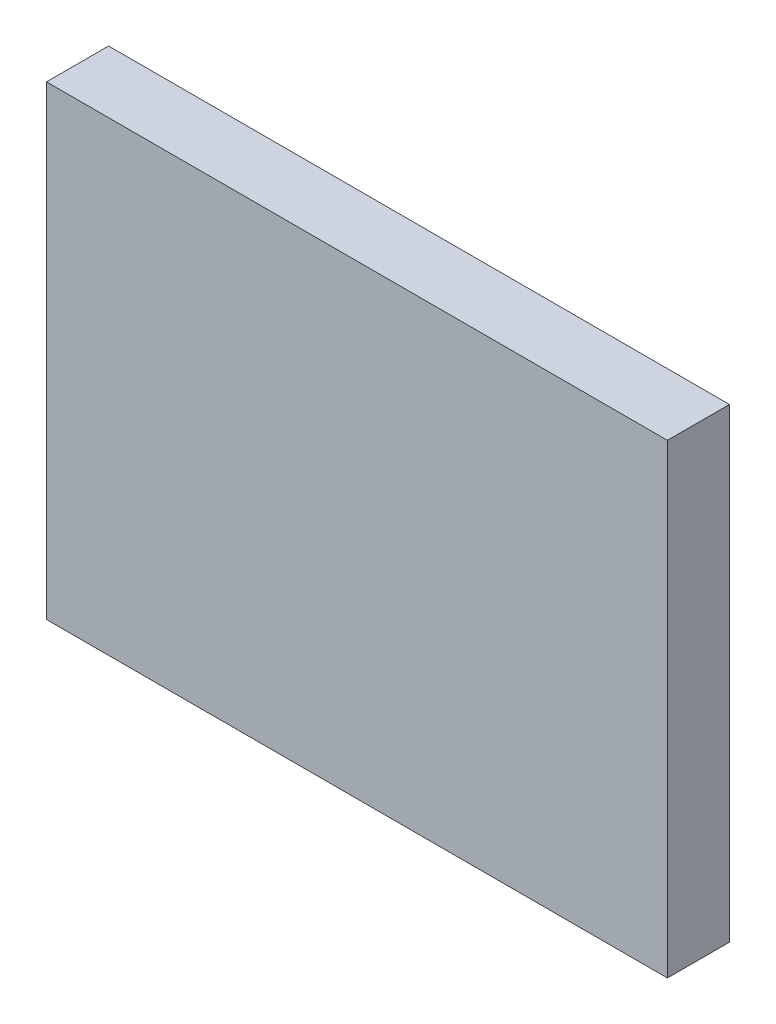
from build123d import *

# Parameters (mm, degrees)
SKETCH1_W           = 20
SKETCH1_H           = 15
BOSS_EXTRUDE1_DEPTH = 2


with BuildPart() as part:
    # Sketch1 → Boss-Extrude1 (new body)
    with BuildSketch(Plane.XY):
        Rectangle(SKETCH1_W, SKETCH1_H)
    extrude(amount=BOSS_EXTRUDE1_DEPTH)


solid = part.part
